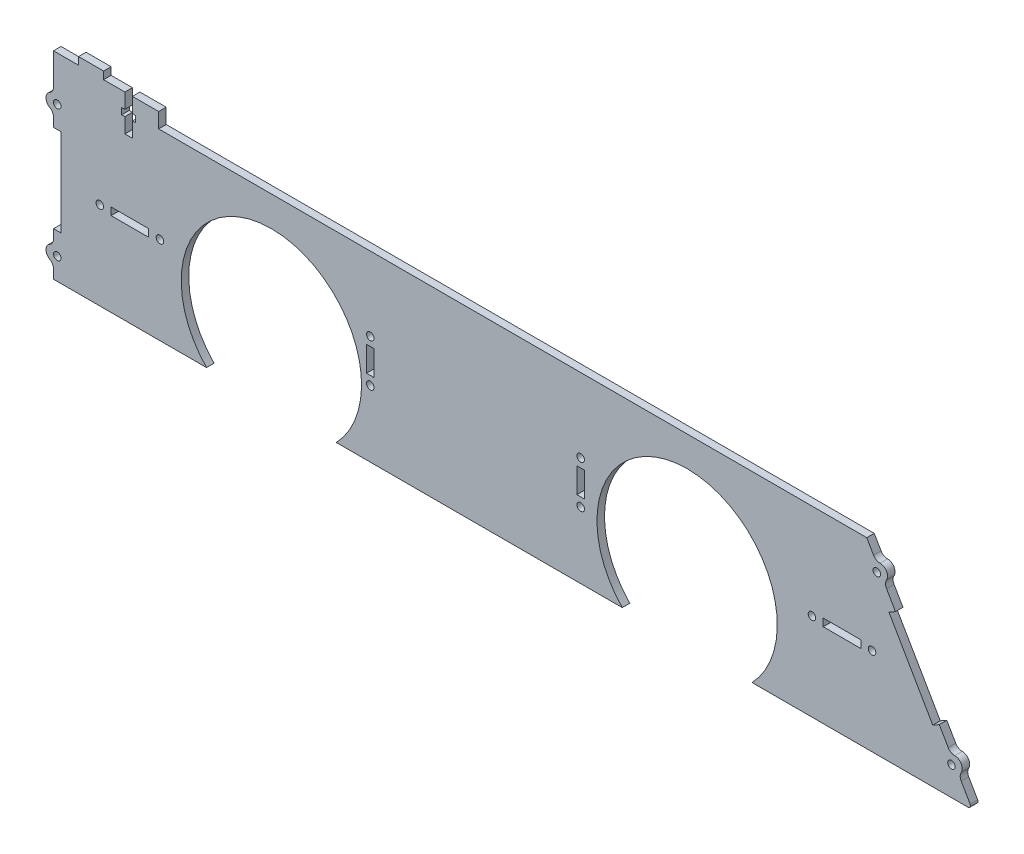
from build123d import *

# Parameters (mm, degrees)
EXTRUDE_1_DEPTH      = 3
SKETCH_2_W           = 3
SKETCH_2_H           = 35
CUT_EXTRUDE_1_DEPTH  = 3
CUT_EXTRUDE_2_DEPTH  = 3
SKETCH_4_W           = 3
SKETCH_4_H           = 10
CUT_EXTRUDE_3_DEPTH  = 3
SKETCH_5_W           = 15
SKETCH_5_H           = 3
CUT_EXTRUDE_4_DEPTH  = 3
SKETCH_6_W           = 42
SKETCH_6_H           = 3
EXTRUDE_2_DEPTH      = 6
SKETCH_8_W           = 3
SKETCH_8_H           = 3
SKETCH_9_W           = 3
SKETCH_9_H           = 3
SKETCH_7_R           = 1.5
CUT_EXTRUDE_6_DEPTH  = 3
FILLET_1_R           = 3
SKETCH_14_R          = 1.5
CUT_EXTRUDE_9_DEPTH  = 3
SKETCH_15_R          = 1.5
CUT_EXTRUDE_10_DEPTH = 3
SKETCH_16_W          = 3
SKETCH_16_H          = 3
SKETCH_17_W          = 3
SKETCH_17_H          = 3
SKETCH_18_R          = 1.5
CUT_EXTRUDE_11_DEPTH = 3
FILLET_2_R           = 3
SKETCH_19_R          = 36
CUT_EXTRUDE_12_DEPTH = 3
CUT_EXTRUDE_13_DEPTH = 3
SKETCH_21_W          = 10
SKETCH_21_H          = 3
EXTRUDE_3_DEPTH      = 3
FILLET_3_R           = 1


with BuildPart() as part:
    # Эскиз1 → Бобышка-Вытянуть1 (new body)
    with BuildSketch(Plane.XY):
        Polygon((-42.146569651, 73), (0, 0), (-366.876569651, 0), (-366.876569651, 73), align=None)
    extrude(amount=EXTRUDE_1_DEPTH)

    # Эскиз2 → Вырез-Вытянуть1 (cut)
    with BuildSketch(Plane.XY.offset(3)):
        with Locations((-365.376569651, 35)):
            Rectangle(SKETCH_2_W, SKETCH_2_H)
    extrude(amount=-CUT_EXTRUDE_1_DEPTH, mode=Mode.SUBTRACT)

    # Эскиз3 → Вырез-Вытянуть2 (cut)
    with BuildSketch(Plane.XY.offset(3)):
        Polygon((-33.287386441, 51.655444566), (-30.689310229, 53.155444566), (-13.189310229, 22.844555434), (-15.787386441, 21.344555434), align=None)
    extrude(amount=-CUT_EXTRUDE_2_DEPTH, mode=Mode.SUBTRACT)

    # Эскиз4 → Вырез-Вытянуть3 (cut)
    with BuildSketch(Plane.XY.offset(3)):
        with Locations((-240.376569651, 35)):
            Rectangle(SKETCH_4_W, SKETCH_4_H)
        with Locations((-156.376569651, 35)):
            Rectangle(SKETCH_4_W, SKETCH_4_H)
    extrude(amount=-CUT_EXTRUDE_3_DEPTH, mode=Mode.SUBTRACT)

    # Эскиз5 → Вырез-Вытянуть4 (cut)
    with BuildSketch(Plane.XY.offset(3)):
        with Locations((-336.376569651, 35)):
            Rectangle(SKETCH_5_W, SKETCH_5_H)
        with Locations((-52.036569651, 35)):
            Rectangle(SKETCH_5_W, SKETCH_5_H)
    extrude(amount=-CUT_EXTRUDE_4_DEPTH, mode=Mode.SUBTRACT)

    # Эскиз6 → Бобышка-Вытянуть2 (add)
    with BuildSketch(Plane(origin=(0, 73, 0), x_dir=(1, 0, 0), z_dir=(0, 1, 0))):
        with Locations((-345.876569651, -1.5)):
            Rectangle(SKETCH_6_W, SKETCH_6_H)
    extrude(amount=EXTRUDE_2_DEPTH)

    # Эскиз8 → Повернуть1 (revolve)
    with BuildSketch(Plane.ZY.offset(366.876569651)):
        with Locations((1.5, 7.25)):
            Rectangle(SKETCH_8_W, SKETCH_8_H)
    revolve(axis=Axis((-366.876569651, 8.75, 0), (0, 0, 1)))

    # Эскиз9 → Повернуть2 (revolve)
    with BuildSketch(Plane.ZY.offset(366.876569651)):
        with Locations((1.5, 59.75)):
            Rectangle(SKETCH_9_W, SKETCH_9_H)
    revolve(axis=Axis((-366.876569651, 61.25, 0), (0, 0, 1)))

    # Эскиз7 → Вырез-Вытянуть6 (cut)
    with BuildSketch(Plane.XY.offset(3)):
        with Locations((-365.376569651, 8.75)):
            Circle(SKETCH_7_R)
        with Locations(Location((-365.376569651, 61.25, 0), (0, 0, 180))):
            Circle(SKETCH_7_R)
    extrude(amount=-CUT_EXTRUDE_6_DEPTH, mode=Mode.SUBTRACT)

    # Скругление1
    fillet_1_edges = [part.edges().sort_by_distance(p)[0] for p in [
        (-366.876569651, 5.75, 1.5),
        (-366.876569651, 11.75, 1.5),
        (-366.876569651, 58.25, 1.5),
        (-366.876569651, 64.25, 1.5),
    ]]
    fillet(fillet_1_edges, radius=FILLET_1_R)

    # Эскиз14 → Вырез-Вытянуть9 (cut)
    with BuildSketch(Plane.XY.offset(3)):
        with Locations((-156.376569651, 43.5)):
            Circle(SKETCH_14_R)
        with Locations((-156.376569651, 26.5)):
            Circle(SKETCH_14_R)
        with Locations((-240.376569651, 26.5)):
            Circle(SKETCH_14_R)
        with Locations((-240.376569651, 43.5)):
            Circle(SKETCH_14_R)
    extrude(amount=-CUT_EXTRUDE_9_DEPTH, mode=Mode.SUBTRACT)

    # Эскиз15 → Вырез-Вытянуть10 (cut)
    with BuildSketch(Plane.XY.offset(3)):
        with Locations((-324.376569651, 35)):
            Circle(SKETCH_15_R)
        with Locations((-348.376569651, 35)):
            Circle(SKETCH_15_R)
        with Locations((-64.036569651, 35)):
            Circle(SKETCH_15_R)
        with Locations((-40.036569651, 35)):
            Circle(SKETCH_15_R)
    extrude(amount=-CUT_EXTRUDE_10_DEPTH, mode=Mode.SUBTRACT)

    # Эскиз16 → Повернуть3 (revolve)
    with BuildSketch(Plane(origin=(0, 0, 0), x_dir=(0, 0, -1), z_dir=(0.8660254037844265, 0.5000000000000212, 0))):
        with Locations((-1.5, 12.558620458)):
            Rectangle(SKETCH_16_W, SKETCH_16_H)
    revolve(axis=Axis((-7.029310229, 12.175122459, 3), (0, 0, -1)))

    # Эскиз17 → Повернуть4 (revolve)
    with BuildSketch(Plane(origin=(0, 0, 0), x_dir=(0, 0, -1), z_dir=(0.8660254037844265, 0.5000000000000212, 0))):
        with Locations((-1.5, 75.198620458)):
            Rectangle(SKETCH_17_W, SKETCH_17_H)
    revolve(axis=Axis((-36.849310229, 63.824877541, 3), (0, 0, -1)))

    # Эскиз18 → Вырез-Вытянуть11 (cut)
    with BuildSketch(Plane.XY.offset(3)):
        with Locations((-38.149990748, 63.077722283)):
            Circle(SKETCH_18_R)
        with Locations((-8.326705922, 11.422277717)):
            Circle(SKETCH_18_R)
    extrude(amount=-CUT_EXTRUDE_11_DEPTH, mode=Mode.SUBTRACT)

    # Скругление2
    fillet_2_edges = [part.edges().sort_by_distance(p)[0] for p in [
        (-5.529310229, 9.577046248, 1.5),
        (-8.529310229, 14.773198671, 1.5),
        (-35.349310229, 61.226801329, 1.5),
        (-38.349310229, 66.422953752, 1.5),
    ]]
    fillet(fillet_2_edges, radius=FILLET_2_R)

    # Эскиз19 → Вырез-Вытянуть12 (cut)
    with BuildSketch(Plane.XY.offset(3)):
        with Locations((-279.876569651, 25)):
            Circle(SKETCH_19_R)
        with Locations((-113.876569651, 25)):
            Circle(SKETCH_19_R)
    extrude(amount=-CUT_EXTRUDE_12_DEPTH, mode=Mode.SUBTRACT)

    # Эскиз20 → Вырез-Вытянуть13 (cut)
    with BuildSketch(Plane.XY.offset(3)):
        Polygon((-338.376569651, 79), (-338.376569651, 73), (-339.626569651, 73), (-339.626569651, 70.5), (-338.376569651, 70.5), (-338.376569651, 64.5), (-335.376569651, 64.5), (-335.376569651, 70.5), (-334.126569651, 70.5), (-334.126569651, 73), (-335.376569651, 73), (-335.376569651, 79), align=None)
    extrude(amount=-CUT_EXTRUDE_13_DEPTH, mode=Mode.SUBTRACT)

    # Эскиз21 → Бобышка-Вытянуть3 (add)
    with BuildSketch(Plane(origin=(0, 79, 0), x_dir=(1, 0, 0), z_dir=(0, 1, 0))):
        with Locations((-351.876569651, -1.5)):
            Rectangle(SKETCH_21_W, SKETCH_21_H)
    extrude(amount=EXTRUDE_3_DEPTH)

    # Скругление3
    fillet_3_edges = [part.edges().sort_by_distance(p)[0] for p in [
        (0, 0, 1.5),
    ]]
    fillet(fillet_3_edges, radius=FILLET_3_R)


solid = part.part
